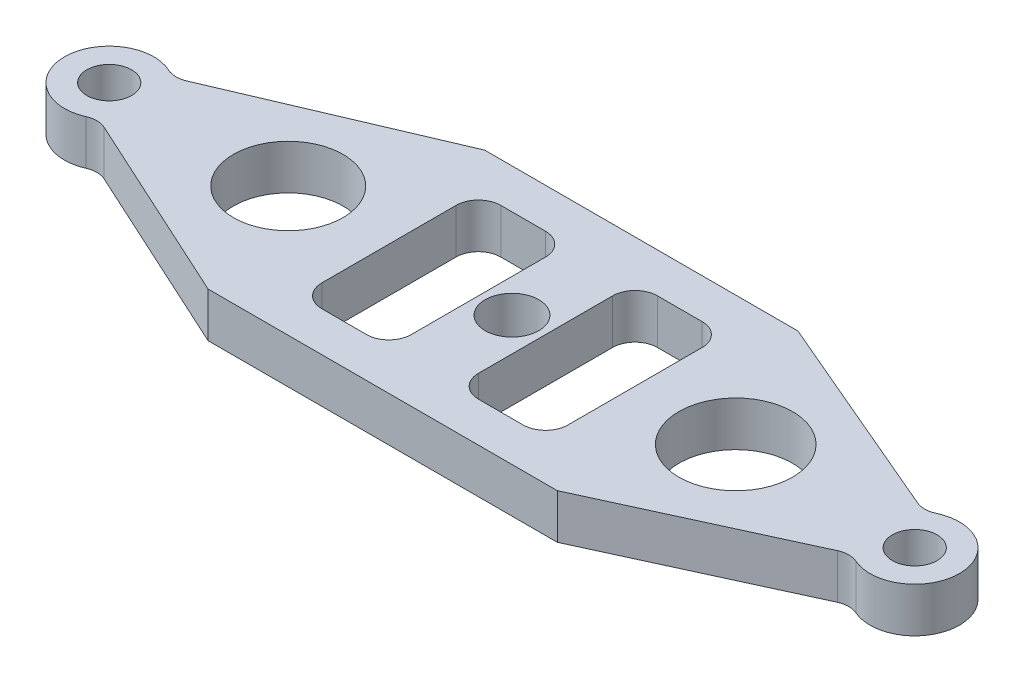
from build123d import *

# Parameters (mm, degrees)
CROQUIS1_R              = 12.7
CROQUIS1_R_2            = 12.25
CROQUIS1_R_3            = 5
CROQUIS1_R_4            = 6
SALIENTE_EXTRUIR1_DEPTH = 10


with BuildPart() as part:
    # Croquis1 → Saliente-Extruir1 (new body)
    with BuildSketch(Plane(origin=(0, 0, 0), x_dir=(1, 0, 0), z_dir=(0, 1, 0))):
        with BuildLine():
            Line((-35, 28.891912333), (35, 28.891912333))
            Line((35, 28.891912333), (81.677313088, 8.985147888))
            ThreePointArc((81.677313088, 8.985147888), (83.725830982, 8.585112915), (85.759177009, 9.056236545))
            ThreePointArc((85.759177009, 9.056236545), (99.999086859, 0.13513694), (86.005469996, -9.167536749))
            ThreePointArc((86.005469996, -9.167536749), (83.960134549, -8.751536206), (81.923175769, -9.206786103))
            Line((81.923175769, -9.206786103), (39.017575448, -28.891912333))
            Line((39.017575448, -28.891912333), (-39.017575448, -28.891912333))
            Line((-39.017575448, -28.891912333), (-81.923175769, -9.206786103))
            ThreePointArc((-81.923175769, -9.206786103), (-83.960134549, -8.751536206), (-86.005469996, -9.167536749))
            ThreePointArc((-86.005469996, -9.167536749), (-99.999086859, 0.13513694), (-85.759177009, 9.056236545))
            ThreePointArc((-85.759177009, 9.056236545), (-83.725830982, 8.585112915), (-81.677313088, 8.985147888))
            Line((-81.677313088, 8.985147888), (-35, 28.891912333))
        make_face()
        with Locations(Location((50, 0, 0), (0, 0, 270))):
            Circle(CROQUIS1_R, mode=Mode.SUBTRACT)
        with Locations(Location((-50, 0, 0), (0, 0, 270))):
            Circle(CROQUIS1_R_2, mode=Mode.SUBTRACT)
        with Locations(Location((-90, 0, 0), (0, 0, 270))):
            Circle(CROQUIS1_R_3, mode=Mode.SUBTRACT)
        with Locations(Location((90, 0, 0), (0, 0, 270))):
            Circle(CROQUIS1_R_3, mode=Mode.SUBTRACT)
        with Locations(Location((0, 0, 0), (0, 0, 270))):
            Circle(CROQUIS1_R_4, mode=Mode.SUBTRACT)
        with BuildLine():
            Line((-22.5, 20), (-12.5, 20))
            ThreePointArc((-12.5, 20), (-8.964466094, 18.535533906), (-7.5, 15))
            Line((-7.5, 15), (-7.5, -15))
            ThreePointArc((-7.5, -15), (-8.964466094, -18.535533906), (-12.5, -20))
            Line((-12.5, -20), (-22.5, -20))
            ThreePointArc((-22.5, -20), (-26.035533906, -18.535533906), (-27.5, -15))
            Line((-27.5, -15), (-27.5, 15))
            ThreePointArc((-27.5, 15), (-26.035533906, 18.535533906), (-22.5, 20))
        make_face(mode=Mode.SUBTRACT)
        with BuildLine():
            Line((12.5, 20), (22.5, 20))
            ThreePointArc((22.5, 20), (26.035533906, 18.535533906), (27.5, 15))
            Line((27.5, 15), (27.5, -15))
            ThreePointArc((27.5, -15), (26.035533906, -18.535533906), (22.5, -20))
            Line((22.5, -20), (12.5, -20))
            ThreePointArc((12.5, -20), (8.964466094, -18.535533906), (7.5, -15))
            Line((7.5, -15), (7.5, 15))
            ThreePointArc((7.5, 15), (8.964466094, 18.535533906), (12.5, 20))
        make_face(mode=Mode.SUBTRACT)
    extrude(amount=SALIENTE_EXTRUIR1_DEPTH)


solid = part.part
